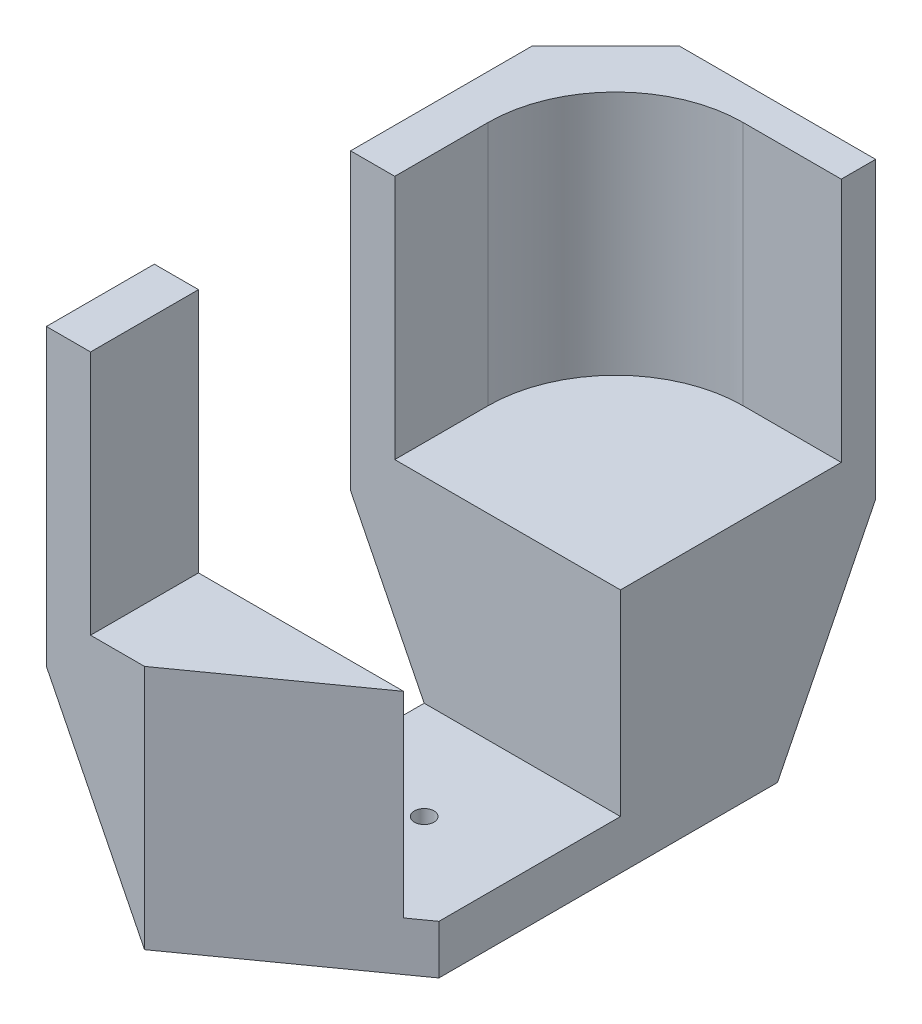
from build123d import *

# Parameters (mm, degrees)
SKETCH_1_R               = 2
EXTRUDE_1_DEPTH          = 50
CHAMFER_1_SIZE           = 15
EXTRUDE_2_DEPTH          = 50
CUT_EXTRUDE_1_DEPTH      = 50
CUT_EXTRUDE_1_DEPTH_BACK = 40
SKETCH_3_W               = 55
SKETCH_3_H               = 40
CUT_EXTRUDE_2_DEPTH      = 156.630973781
CUT_EXTRUDE_3_DEPTH      = 135.940727729
CHAMFER_2_SIZE           = 13.693


with BuildPart() as part:
    # 草图1 → 凸台-拉伸1 (new body)
    with BuildSketch(Plane(origin=(0, 0, 0), x_dir=(1, 0, 0), z_dir=(0, 1, 0))):
        Polygon((-35, 72), (-35, -42), (-15, -42), (20, -17), (20, 14.02557275), (20, 72), align=None)
        with Locations(Location((0, 0, 0), (0, 0, 270))):
            Circle(SKETCH_1_R, mode=Mode.SUBTRACT)
    extrude(amount=EXTRUDE_1_DEPTH)

    # 倒角1
    chamfer_1_edges = [part.edges().sort_by_distance(p)[0] for p in [
        (-35, 25, -72),
    ]]
    chamfer(chamfer_1_edges, length=CHAMFER_1_SIZE)

    # 草图2 → 凸台-拉伸2 (add)
    with BuildSketch(Plane(origin=(0, 50, 0), x_dir=(1, 0, 0), z_dir=(0, 1, 0))):
        with BuildLine():
            Line((-26, 39), (-26, -42))
            Line((-26, -42), (-35, -42))
            Line((-35, -42), (-35, 57))
            Line((-35, 57), (-20, 72))
            Line((-20, 72), (20, 72))
            Line((20, 72), (20, 65))
            Line((20, 65), (0, 65))
            ThreePointArc((0, 65), (-18.384776311, 57.384776311), (-26, 39))
        make_face()
    extrude(amount=EXTRUDE_2_DEPTH)

    # 草图3 → 切除-拉伸1 (cut, two sides: drawn at the far end of the back side and taken through both)
    with BuildSketch(Plane(origin=(0, 50, 0), x_dir=(1, 0, 0), z_dir=(0, 1, 0)).offset(-CUT_EXTRUDE_1_DEPTH_BACK)):
        with Locations((-7.5, 0)):
            Rectangle(SKETCH_3_W, SKETCH_3_H)
    extrude(amount=CUT_EXTRUDE_1_DEPTH + CUT_EXTRUDE_1_DEPTH_BACK, mode=Mode.SUBTRACT)

    # 草图4 → 切除-拉伸2 (cut, through all)
    with BuildSketch(Plane(origin=(0, 0, -72), x_dir=(-1, 0, 0), z_dir=(0, 0, -1))):
        Polygon((15, 0), (35, 40), (35, 0), align=None)
    extrude(amount=-CUT_EXTRUDE_2_DEPTH, mode=Mode.SUBTRACT)

    # 草图5 → 切除-拉伸3 (cut, through all)
    with BuildSketch(Plane(origin=(20, 0, 0), x_dir=(0, 0, -1), z_dir=(1, 0, 0))):
        Polygon((52, 0), (72, 0), (72, 40), align=None)
    extrude(amount=-CUT_EXTRUDE_3_DEPTH, mode=Mode.SUBTRACT)

    # 倒角2
    chamfer_2_edges = [part.edges().sort_by_distance(p)[0] for p in [
        (-21.25, 12.5, -58.25),
    ]]
    chamfer(chamfer_2_edges, length=CHAMFER_2_SIZE)


solid = part.part
